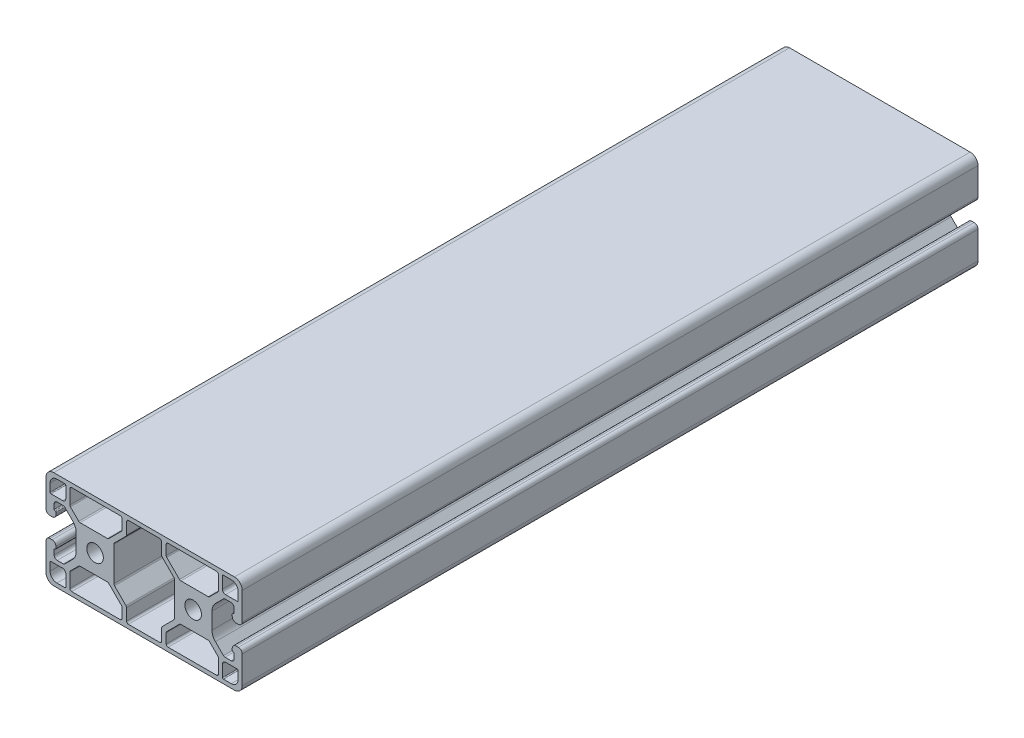
from build123d import *

# Parameters (mm, degrees)
SKETCH1_R      = 3.377777778
EXTRUDE1_DEPTH = 300


with BuildPart() as part:
    # Sketch1 → Extrude1 (new body)
    with BuildSketch(Plane.XY):
        with BuildLine():
            Line((15.428571429, -10.285714286), (12.988478889, -10.285714286))
            ThreePointArc((12.988478889, -10.285714286), (12.648315838, -10.218051648), (12.359939528, -10.025364758))
            Line((12.359939528, -10.025364758), (9.073550017, -6.738975247))
            ThreePointArc((9.073550017, -6.738975247), (8.04405149, -5.198221819), (7.682539683, -3.380779233))
            Line((7.682539683, -3.380779233), (7.682539683, 3.380779233))
            ThreePointArc((7.682539683, 3.380779233), (8.04405149, 5.198221819), (9.073550017, 6.738975247))
            Line((9.073550017, 6.738975247), (12.359939528, 10.025364758))
            ThreePointArc((12.359939528, 10.025364758), (12.648315838, 10.218051648), (12.988478889, 10.285714286))
            Line((12.988478889, 10.285714286), (15.428571429, 10.285714286))
            ThreePointArc((15.428571429, 10.285714286), (16.326484802, 9.913786389), (16.698412698, 9.015873016))
            Line((16.698412698, 9.015873016), (16.698412698, 7.168502803))
            ThreePointArc((16.698412698, 7.168502803), (16.591775152, 6.904565614), (16.331720344, 6.788781753))
            Line((16.331720344, 6.788781753), (16.303200291, 6.787785811))
            ThreePointArc((16.303200291, 6.787785811), (16.043145483, 6.672001951), (15.936507937, 6.408064762))
            Line((15.936507937, 6.408064762), (15.936507937, 5.638095238))
            ThreePointArc((15.936507937, 5.638095238), (16.397698529, 4.524682656), (17.511111111, 4.063492063))
            Line((17.511111111, 4.063492063), (18.425396825, 4.063492063))
            ThreePointArc((18.425396825, 4.063492063), (19.538809408, 4.524682656), (20, 5.638095238))
            Line((20, 5.638095238), (20, 16.825396825))
            ThreePointArc((20, 16.825396825), (19.070180258, 19.070180258), (16.825396825, 20))
            Line((16.825396825, 20), (-56.825396825, 20))
            ThreePointArc((-56.825396825, 20), (-59.070180258, 19.070180258), (-60, 16.825396825))
            Line((-60, 16.825396825), (-60, 5.638095238))
            ThreePointArc((-60, 5.638095238), (-59.538809408, 4.524682656), (-58.425396825, 4.063492063))
            Line((-58.425396825, 4.063492063), (-57.511111111, 4.063492063))
            ThreePointArc((-57.511111111, 4.063492063), (-56.397698529, 4.524682656), (-55.936507937, 5.638095238))
            Line((-55.936507937, 5.638095238), (-55.936507937, 6.344572699))
            ThreePointArc((-55.936507937, 6.344572699), (-56.043145483, 6.608509887), (-56.303200291, 6.724293748))
            Line((-56.303200291, 6.724293748), (-56.331720344, 6.72528969))
            ThreePointArc((-56.331720344, 6.72528969), (-56.591775152, 6.84107355), (-56.698412698, 7.105010739))
            Line((-56.698412698, 7.105010739), (-56.698412698, 9.015873016))
            ThreePointArc((-56.698412698, 9.015873016), (-56.326484802, 9.913786389), (-55.428571429, 10.285714286))
            Line((-55.428571429, 10.285714286), (-52.988478889, 10.285714286))
            ThreePointArc((-52.988478889, 10.285714286), (-52.648315838, 10.218051648), (-52.359939528, 10.025364758))
            Line((-52.359939528, 10.025364758), (-49.073550017, 6.738975247))
            ThreePointArc((-49.073550017, 6.738975247), (-48.04405149, 5.198221819), (-47.682539683, 3.380779233))
            Line((-47.682539683, 3.380779233), (-47.682539683, -3.380779233))
            ThreePointArc((-47.682539683, -3.380779233), (-48.04405149, -5.198221819), (-49.073550017, -6.738975247))
            Line((-49.073550017, -6.738975247), (-52.359939528, -10.025364758))
            ThreePointArc((-52.359939528, -10.025364758), (-52.648315838, -10.218051648), (-52.988478889, -10.285714286))
            Line((-52.988478889, -10.285714286), (-55.428571429, -10.285714286))
            ThreePointArc((-55.428571429, -10.285714286), (-56.326484802, -9.913786389), (-56.698412698, -9.015873016))
            Line((-56.698412698, -9.015873016), (-56.698412698, -7.105010739))
            ThreePointArc((-56.698412698, -7.105010739), (-56.591775152, -6.84107355), (-56.331720344, -6.72528969))
            Line((-56.331720344, -6.72528969), (-56.303200291, -6.724293748))
            ThreePointArc((-56.303200291, -6.724293748), (-56.043145483, -6.608509887), (-55.936507937, -6.344572699))
            Line((-55.936507937, -6.344572699), (-55.936507937, -5.638095238))
            ThreePointArc((-55.936507937, -5.638095238), (-56.397698529, -4.524682656), (-57.511111111, -4.063492063))
            Line((-57.511111111, -4.063492063), (-58.425396825, -4.063492063))
            ThreePointArc((-58.425396825, -4.063492063), (-59.538809408, -4.524682656), (-60, -5.638095238))
            Line((-60, -5.638095238), (-60, -16.825396825))
            ThreePointArc((-60, -16.825396825), (-59.070180258, -19.070180258), (-56.825396825, -20))
            Line((-56.825396825, -20), (16.825396825, -20))
            ThreePointArc((16.825396825, -20), (19.070180258, -19.070180258), (20, -16.825396825))
            Line((20, -16.825396825), (20, -5.638095238))
            ThreePointArc((20, -5.638095238), (19.538809408, -4.524682656), (18.425396825, -4.063492063))
            Line((18.425396825, -4.063492063), (17.511111111, -4.063492063))
            ThreePointArc((17.511111111, -4.063492063), (16.397698529, -4.524682656), (15.936507937, -5.638095238))
            Line((15.936507937, -5.638095238), (15.936507937, -6.408064762))
            ThreePointArc((15.936507937, -6.408064762), (16.043145483, -6.672001951), (16.303200291, -6.787785811))
            Line((16.303200291, -6.787785811), (16.331720344, -6.788781753))
            ThreePointArc((16.331720344, -6.788781753), (16.591775152, -6.904565614), (16.698412698, -7.168502803))
            Line((16.698412698, -7.168502803), (16.698412698, -9.015873016))
            ThreePointArc((16.698412698, -9.015873016), (16.326484802, -9.913786389), (15.428571429, -10.285714286))
        make_face()
        Circle(SKETCH1_R, mode=Mode.SUBTRACT)
        with Locations((-40, 0)):
            Circle(SKETCH1_R, mode=Mode.SUBTRACT)
        with BuildLine():
            Line((-52.316460442, -18.349206349), (-55.555507937, -18.349206349))
            ThreePointArc((-55.555507937, -18.349206349), (-57.531164283, -17.530862696), (-58.349507937, -15.555206349))
            Line((-58.349507937, -15.555206349), (-58.349507937, -12.316507937))
            ThreePointArc((-58.349507937, -12.316507937), (-58.238208513, -12.04780736), (-57.969507937, -11.936507937))
            Line((-57.969507937, -11.936507937), (-53.206349206, -11.936507937))
            ThreePointArc((-53.206349206, -11.936507937), (-52.308435833, -12.308435833), (-51.936507937, -13.206349206))
            Line((-51.936507937, -13.206349206), (-51.936507937, -17.969253843))
            ThreePointArc((-51.936507937, -17.969253843), (-52.047793449, -18.237920837), (-52.316460442, -18.349206349))
        make_face(mode=Mode.SUBTRACT)
        with BuildLine():
            Line((-55.555507937, 18.349206349), (-52.316460442, 18.349206349))
            ThreePointArc((-52.316460442, 18.349206349), (-52.047793449, 18.237920837), (-51.936507937, 17.969253843))
            Line((-51.936507937, 17.969253843), (-51.936507937, 13.206349206))
            ThreePointArc((-51.936507937, 13.206349206), (-52.308435833, 12.308435833), (-53.206349206, 11.936507937))
            Line((-53.206349206, 11.936507937), (-57.969507937, 11.936507937))
            ThreePointArc((-57.969507937, 11.936507937), (-58.238208513, 12.04780736), (-58.349507937, 12.316507937))
            Line((-58.349507937, 12.316507937), (-58.349507937, 15.555206349))
            ThreePointArc((-58.349507937, 15.555206349), (-57.531164283, 17.530862696), (-55.555507937, 18.349206349))
        make_face(mode=Mode.SUBTRACT)
        with BuildLine():
            Line((15.555507937, -18.349206349), (12.316460442, -18.349206349))
            ThreePointArc((12.316460442, -18.349206349), (12.047793449, -18.237920837), (11.936507937, -17.969253843))
            Line((11.936507937, -17.969253843), (11.936507937, -13.206349206))
            ThreePointArc((11.936507937, -13.206349206), (12.308435833, -12.308435833), (13.206349206, -11.936507937))
            Line((13.206349206, -11.936507937), (17.969507937, -11.936507937))
            ThreePointArc((17.969507937, -11.936507937), (18.238208513, -12.04780736), (18.349507937, -12.316507937))
            Line((18.349507937, -12.316507937), (18.349507937, -15.555206349))
            ThreePointArc((18.349507937, -15.555206349), (17.531164283, -17.530862696), (15.555507937, -18.349206349))
        make_face(mode=Mode.SUBTRACT)
        with BuildLine():
            Line((12.316460442, 18.349206349), (15.555507937, 18.349206349))
            ThreePointArc((15.555507937, 18.349206349), (17.531164283, 17.530862696), (18.349507937, 15.555206349))
            Line((18.349507937, 15.555206349), (18.349507937, 12.316507937))
            ThreePointArc((18.349507937, 12.316507937), (18.238208513, 12.04780736), (17.969507937, 11.936507937))
            Line((17.969507937, 11.936507937), (13.206349206, 11.936507937))
            ThreePointArc((13.206349206, 11.936507937), (12.308435833, 12.308435833), (11.936507937, 13.206349206))
            Line((11.936507937, 13.206349206), (11.936507937, 17.969253843))
            ThreePointArc((11.936507937, 17.969253843), (12.047793449, 18.237920837), (12.316460442, 18.349206349))
        make_face(mode=Mode.SUBTRACT)
        with BuildLine():
            Line((-10.222222222, 18.349206349), (9.523809524, 18.349206349))
            ThreePointArc((9.523809524, 18.349206349), (10.062557548, 18.126049611), (10.285714286, 17.587301587))
            Line((10.285714286, 17.587301587), (10.285714286, 11.858384293))
            ThreePointArc((10.285714286, 11.858384293), (10.227717739, 11.566815964), (10.062557548, 11.31963627))
            Line((10.062557548, 11.31963627), (6.648617699, 7.905696421))
            ThreePointArc((6.648617699, 7.905696421), (6.401438004, 7.740536229), (6.109869675, 7.682539683))
            Line((6.109869675, 7.682539683), (-5.032373627, 7.682539683))
            ThreePointArc((-5.032373627, 7.682539683), (-5.323941957, 7.740536229), (-5.571121651, 7.905696421))
            Line((-5.571121651, 7.905696421), (-10.760970246, 13.095545016))
            ThreePointArc((-10.760970246, 13.095545016), (-10.926130437, 13.34272471), (-10.984126984, 13.634293039))
            Line((-10.984126984, 13.634293039), (-10.984126984, 17.587301587))
            ThreePointArc((-10.984126984, 17.587301587), (-10.760970246, 18.126049611), (-10.222222222, 18.349206349))
        make_face(mode=Mode.SUBTRACT)
        with BuildLine():
            Line((-46.109869675, -7.682539683), (-34.967626373, -7.682539683))
            ThreePointArc((-34.967626373, -7.682539683), (-34.676058043, -7.740536229), (-34.428878349, -7.905696421))
            Line((-34.428878349, -7.905696421), (-29.239029754, -13.095545016))
            ThreePointArc((-29.239029754, -13.095545016), (-29.073869563, -13.34272471), (-29.015873016, -13.634293039))
            Line((-29.015873016, -13.634293039), (-29.015873016, -17.587301587))
            ThreePointArc((-29.015873016, -17.587301587), (-29.239029754, -18.126049611), (-29.777777778, -18.349206349))
            Line((-29.777777778, -18.349206349), (-49.523809524, -18.349206349))
            ThreePointArc((-49.523809524, -18.349206349), (-50.062557548, -18.126049611), (-50.285714286, -17.587301587))
            Line((-50.285714286, -17.587301587), (-50.285714286, -11.858384293))
            ThreePointArc((-50.285714286, -11.858384293), (-50.227717739, -11.566815964), (-50.062557548, -11.31963627))
            Line((-50.062557548, -11.31963627), (-46.648617699, -7.905696421))
            ThreePointArc((-46.648617699, -7.905696421), (-46.401438004, -7.740536229), (-46.109869675, -7.682539683))
        make_face(mode=Mode.SUBTRACT)
        with BuildLine():
            Line((-46.648617699, 7.905696421), (-50.062557548, 11.31963627))
            ThreePointArc((-50.062557548, 11.31963627), (-50.227717739, 11.566815964), (-50.285714286, 11.858384293))
            Line((-50.285714286, 11.858384293), (-50.285714286, 17.587301587))
            ThreePointArc((-50.285714286, 17.587301587), (-50.062557548, 18.126049611), (-49.523809524, 18.349206349))
            Line((-49.523809524, 18.349206349), (-29.777777778, 18.349206349))
            ThreePointArc((-29.777777778, 18.349206349), (-29.239029754, 18.126049611), (-29.015873016, 17.587301587))
            Line((-29.015873016, 17.587301587), (-29.015873016, 13.634293039))
            ThreePointArc((-29.015873016, 13.634293039), (-29.073869563, 13.34272471), (-29.239029754, 13.095545016))
            Line((-29.239029754, 13.095545016), (-34.428878349, 7.905696421))
            ThreePointArc((-34.428878349, 7.905696421), (-34.676058043, 7.740536229), (-34.967626373, 7.682539683))
            Line((-34.967626373, 7.682539683), (-46.109869675, 7.682539683))
            ThreePointArc((-46.109869675, 7.682539683), (-46.401438004, 7.740536229), (-46.648617699, 7.905696421))
        make_face(mode=Mode.SUBTRACT)
        with BuildLine():
            Line((-10.760970246, -13.095545016), (-5.571121651, -7.905696421))
            ThreePointArc((-5.571121651, -7.905696421), (-5.323941957, -7.740536229), (-5.032373627, -7.682539683))
            Line((-5.032373627, -7.682539683), (6.109869675, -7.682539683))
            ThreePointArc((6.109869675, -7.682539683), (6.401438004, -7.740536229), (6.648617699, -7.905696421))
            Line((6.648617699, -7.905696421), (10.062557548, -11.31963627))
            ThreePointArc((10.062557548, -11.31963627), (10.227717739, -11.566815964), (10.285714286, -11.858384293))
            Line((10.285714286, -11.858384293), (10.285714286, -17.587301587))
            ThreePointArc((10.285714286, -17.587301587), (10.062557548, -18.126049611), (9.523809524, -18.349206349))
            Line((9.523809524, -18.349206349), (-10.222222222, -18.349206349))
            ThreePointArc((-10.222222222, -18.349206349), (-10.760970246, -18.126049611), (-10.984126984, -17.587301587))
            Line((-10.984126984, -17.587301587), (-10.984126984, -13.634293039))
            ThreePointArc((-10.984126984, -13.634293039), (-10.926130437, -13.34272471), (-10.760970246, -13.095545016))
        make_face(mode=Mode.SUBTRACT)
        with BuildLine():
            Line((-27.434985246, -12.205849405), (-32.057078246, -7.583756405))
            ThreePointArc((-32.057078246, -7.583756405), (-32.249789222, -7.295344048), (-32.317460317, -6.955138476))
            Line((-32.317460317, -6.955138476), (-32.317460317, 7.007783048))
            ThreePointArc((-32.317460317, 7.007783048), (-32.259463771, 7.299351377), (-32.094303579, 7.546531072))
            Line((-32.094303579, 7.546531072), (-27.334267849, 12.306566802))
            ThreePointArc((-27.334267849, 12.306566802), (-27.169107658, 12.553746496), (-27.111111111, 12.845314825))
            Line((-27.111111111, 12.845314825), (-27.111111111, 17.587301587))
            ThreePointArc((-27.111111111, 17.587301587), (-26.887954373, 18.126049611), (-26.349206349, 18.349206349))
            Line((-26.349206349, 18.349206349), (-13.650793651, 18.349206349))
            ThreePointArc((-13.650793651, 18.349206349), (-13.112045627, 18.126049611), (-12.888888889, 17.587301587))
            Line((-12.888888889, 17.587301587), (-12.888888889, 12.845314825))
            ThreePointArc((-12.888888889, 12.845314825), (-12.830892342, 12.553746496), (-12.665732151, 12.306566802))
            Line((-12.665732151, 12.306566802), (-7.905696421, 7.546531072))
            ThreePointArc((-7.905696421, 7.546531072), (-7.740536229, 7.299351377), (-7.682539683, 7.007783048))
            Line((-7.682539683, 7.007783048), (-7.682539683, -6.955138476))
            ThreePointArc((-7.682539683, -6.955138476), (-7.750210778, -7.295344048), (-7.942921754, -7.583756405))
            Line((-7.942921754, -7.583756405), (-12.565014754, -12.205849405))
            ThreePointArc((-12.565014754, -12.205849405), (-12.75772573, -12.494261762), (-12.825396825, -12.834467333))
            Line((-12.825396825, -12.834467333), (-12.825396825, -17.587301587))
            ThreePointArc((-12.825396825, -17.587301587), (-13.048553564, -18.126049611), (-13.587301587, -18.349206349))
            Line((-13.587301587, -18.349206349), (-26.412698413, -18.349206349))
            ThreePointArc((-26.412698413, -18.349206349), (-26.951446436, -18.126049611), (-27.174603175, -17.587301587))
            Line((-27.174603175, -17.587301587), (-27.174603175, -12.834467333))
            ThreePointArc((-27.174603175, -12.834467333), (-27.24227427, -12.494261762), (-27.434985246, -12.205849405))
        make_face(mode=Mode.SUBTRACT)
    extrude(amount=-EXTRUDE1_DEPTH)


solid = part.part
